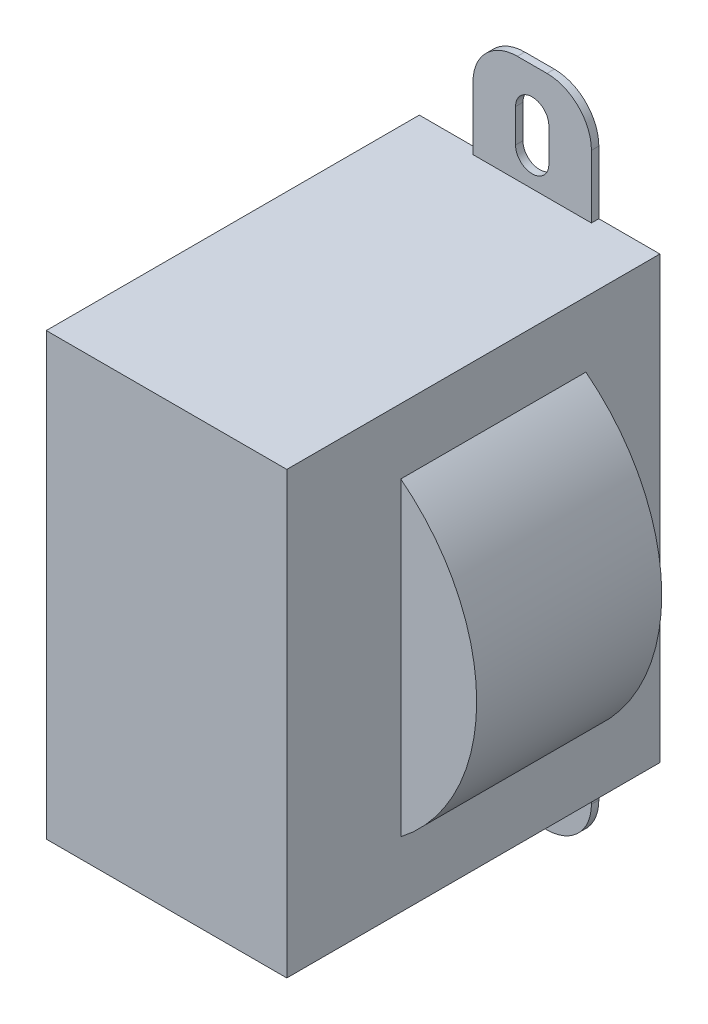
from build123d import *

# Parameters (mm, degrees)
SKETCH_1_W      = 32.5
SKETCH_1_H      = 59.5
EXTRUDE_1_DEPTH = 42.4
EXTRUDE_2_DEPTH = 25
EXTRUDE_3_DEPTH = 1
SKETCH_5_W      = 32.493243018
SKETCH_5_H      = 59.5
EXTRUDE_5_DEPTH = 8


with BuildPart() as part:
    # 草图1 → 拉伸1 (new body)
    with BuildSketch(Plane.XY):
        Rectangle(SKETCH_1_W, SKETCH_1_H)
    extrude(amount=EXTRUDE_1_DEPTH)

    # 草图2 → 拉伸2 (add)
    with BuildSketch(Plane.XY.offset(10)):
        with BuildLine():
            Line((-16.25, 20.932928605), (16.25, 20.932928605))
            ThreePointArc((16.25, 20.932928605), (26.5, 0), (16.25, -20.932928605))
            Line((16.25, -20.932928605), (-16.25, -20.932928605))
            ThreePointArc((-16.25, -20.932928605), (-26.5, 0), (-16.25, 20.932928605))
        make_face()
    extrude(amount=EXTRUDE_2_DEPTH)

    # 草图4 → 拉伸3 (add)
    # profile 1 of 2: a face of its own
    with BuildSketch(Plane.XY):
        with BuildLine():
            Line((-2, 44.25), (2, 44.25))
            ThreePointArc((2, 44.25), (6.242640687, 42.492640687), (8, 38.25))
            Line((8, 38.25), (8, 29.75))
            Line((8, 29.75), (-8, 29.75))
            Line((-8, 29.75), (-8, 38.25))
            ThreePointArc((-8, 38.25), (-6.242640687, 42.492640687), (-2, 44.25))
        make_face()
        with BuildLine():
            Line((-2.25, 38.25), (-2.25, 33.75))
            ThreePointArc((-2.25, 33.75), (0, 31.5), (2.25, 33.75))
            Line((2.25, 33.75), (2.25, 38.25))
            ThreePointArc((2.25, 38.25), (0, 40.5), (-2.25, 38.25))
        make_face(mode=Mode.SUBTRACT)
    # profile 2 of 2: a face of its own
    with BuildSketch(Plane.XY):
        with BuildLine():
            Line((-2, -44.25), (2, -44.25))
            ThreePointArc((2, -44.25), (6.242640687, -42.492640687), (8, -38.25))
            Line((8, -38.25), (8, -29.75))
            Line((8, -29.75), (-8, -29.75))
            Line((-8, -29.75), (-8, -38.25))
            ThreePointArc((-8, -38.25), (-6.242640687, -42.492640687), (-2, -44.25))
        make_face()
        with BuildLine():
            Line((2.25, -38.25), (2.25, -33.75))
            ThreePointArc((2.25, -33.75), (0, -31.5), (-2.25, -33.75))
            Line((-2.25, -33.75), (-2.25, -38.25))
            ThreePointArc((-2.25, -38.25), (0, -40.5), (2.25, -38.25))
        make_face(mode=Mode.SUBTRACT)
    extrude(amount=EXTRUDE_3_DEPTH)

    # 草图5 → 拉伸5 (add)
    with BuildSketch(Plane.XY.offset(42.4)):
        with Locations((0.003378491, 0)):
            Rectangle(SKETCH_5_W, SKETCH_5_H)
    extrude(amount=EXTRUDE_5_DEPTH)


solid = part.part
